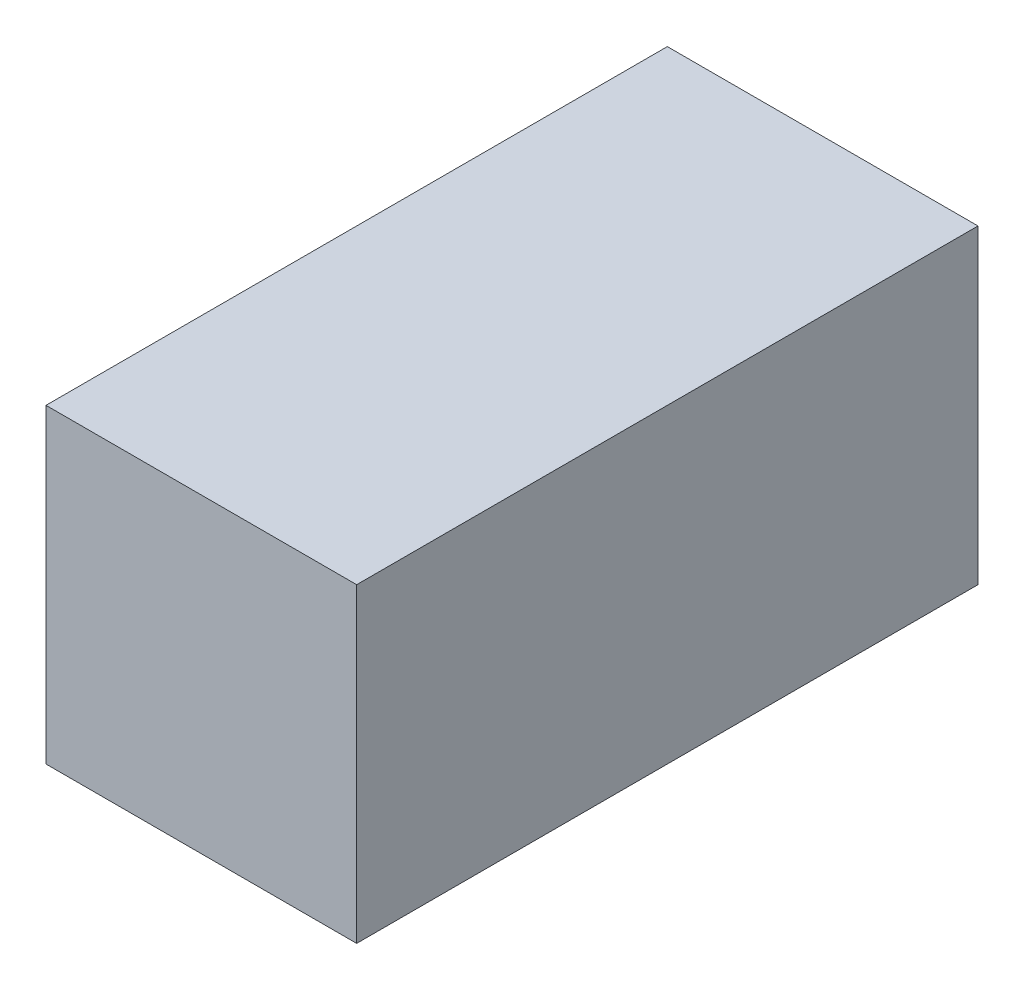
from build123d import *

# Parameters (mm, degrees)
ESBO_O1_W       = 5
ESBO_O1_H       = 5
EXTRUS_O1_DEPTH = 10


with BuildPart() as part:
    # Esboço1 → Extrusão1 (new body)
    with BuildSketch(Plane.XY):
        with Locations((2.5, 2.5)):
            Rectangle(ESBO_O1_W, ESBO_O1_H)
    extrude(amount=EXTRUS_O1_DEPTH)


solid = part.part
